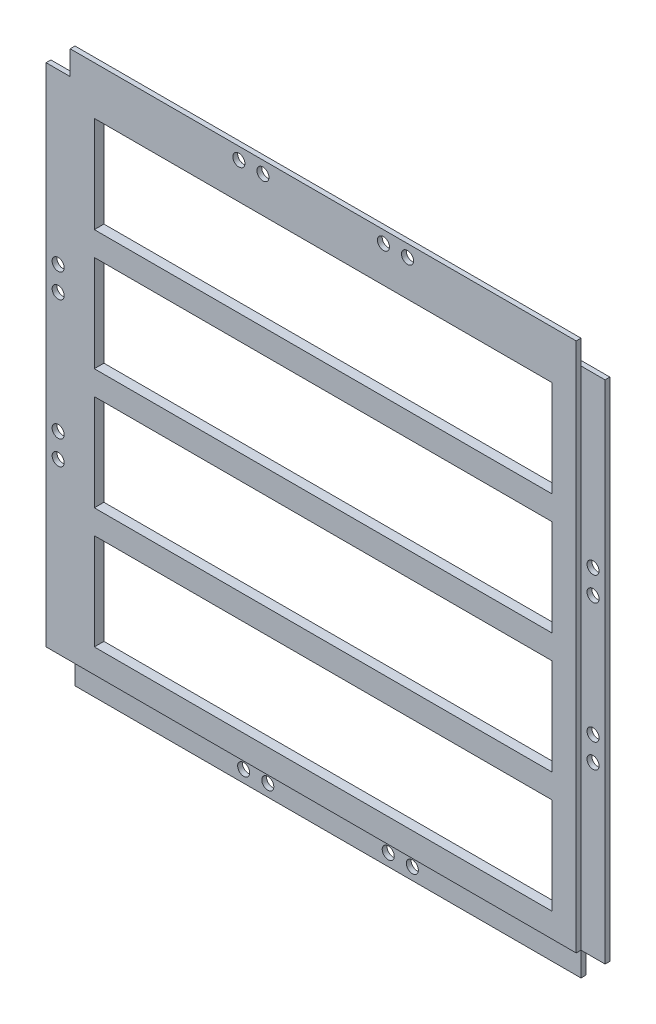
from build123d import *

# Parameters (mm, degrees)
EXTRUDE_1_DEPTH     = 4
SKETCH_2_W          = 10
SKETCH_2_H          = 210
SKETCH_2_W_2        = 210
SKETCH_2_H_2        = 10
CUT_EXTRUDE_1_DEPTH = 2
SKETCH_3_W          = 210
SKETCH_3_H          = 10
SKETCH_3_W_2        = 10
SKETCH_3_H_2        = 210
CUT_EXTRUDE_2_DEPTH = 2
SKETCH_4_R          = 2.5
CUT_EXTRUDE_3_DEPTH = 326.293713434
SKETCH_5_W          = 190
SKETCH_5_H          = 40
CUT_EXTRUDE_4_DEPTH = 326.293713434


with BuildPart() as part:
    # 草图1 → 凸台-拉伸1 (new body)
    with BuildSketch(Plane.XY):
        Polygon((10, 0), (10, 10), (0, 10), (0, 220), (10, 220), (10, 230), (220, 230), (220, 220), (230, 220), (230, 10), (220, 10), (220, 0), align=None)
    extrude(amount=EXTRUDE_1_DEPTH)

    # 草图2 → 切除-拉伸1 (cut)
    with BuildSketch(Plane.XY.offset(4)):
        with Locations((225, 115)):
            Rectangle(SKETCH_2_W, SKETCH_2_H)
        with Locations((115, 5)):
            Rectangle(SKETCH_2_W_2, SKETCH_2_H_2)
    extrude(amount=-CUT_EXTRUDE_1_DEPTH, mode=Mode.SUBTRACT)

    # 草图3 → 切除-拉伸2 (cut)
    with BuildSketch(Plane(origin=(0, 0, 0), x_dir=(-1, 0, 0), z_dir=(0, 0, -1))):
        with Locations((-115, 225)):
            Rectangle(SKETCH_3_W, SKETCH_3_H)
        with Locations((-5, 115)):
            Rectangle(SKETCH_3_W_2, SKETCH_3_H_2)
    extrude(amount=-CUT_EXTRUDE_2_DEPTH, mode=Mode.SUBTRACT)

    # 草图4 → 切除-拉伸3 (cut, through all)
    with BuildSketch(Plane.XY.offset(4)):
        with Locations((5, 80)):
            Circle(SKETCH_4_R)
        with Locations((5, 90)):
            Circle(SKETCH_4_R)
        with Locations(Location((5, 150, 0), (0, 0, 180))):
            Circle(SKETCH_4_R)
        with Locations(Location((5, 140, 0), (0, 0, 180))):
            Circle(SKETCH_4_R)
        with Locations((225, 80)):
            Circle(SKETCH_4_R)
        with Locations((225, 90)):
            Circle(SKETCH_4_R)
        with Locations((225, 140)):
            Circle(SKETCH_4_R)
        with Locations((225, 150)):
            Circle(SKETCH_4_R)
        with Locations((80, 5)):
            Circle(SKETCH_4_R)
        with Locations((90, 5)):
            Circle(SKETCH_4_R)
        with Locations((140, 5)):
            Circle(SKETCH_4_R)
        with Locations((150, 5)):
            Circle(SKETCH_4_R)
        with Locations((150, 225)):
            Circle(SKETCH_4_R)
        with Locations((140, 225)):
            Circle(SKETCH_4_R)
        with Locations(Location((90, 225, 0), (0, 0, 180))):
            Circle(SKETCH_4_R)
        with Locations(Location((80, 225, 0), (0, 0, 180))):
            Circle(SKETCH_4_R)
    extrude(amount=-CUT_EXTRUDE_3_DEPTH, mode=Mode.SUBTRACT)

    # 草图5 → 切除-拉伸4 (cut, through all)
    with BuildSketch(Plane.XY.offset(4)):
        with Locations((115, 40)):
            Rectangle(SKETCH_5_W, SKETCH_5_H)
        with Locations((115, 90)):
            Rectangle(SKETCH_5_W, SKETCH_5_H)
        with Locations((115, 140)):
            Rectangle(SKETCH_5_W, SKETCH_5_H)
        with Locations((115, 190)):
            Rectangle(SKETCH_5_W, SKETCH_5_H)
    extrude(amount=-CUT_EXTRUDE_4_DEPTH, mode=Mode.SUBTRACT)


solid = part.part
